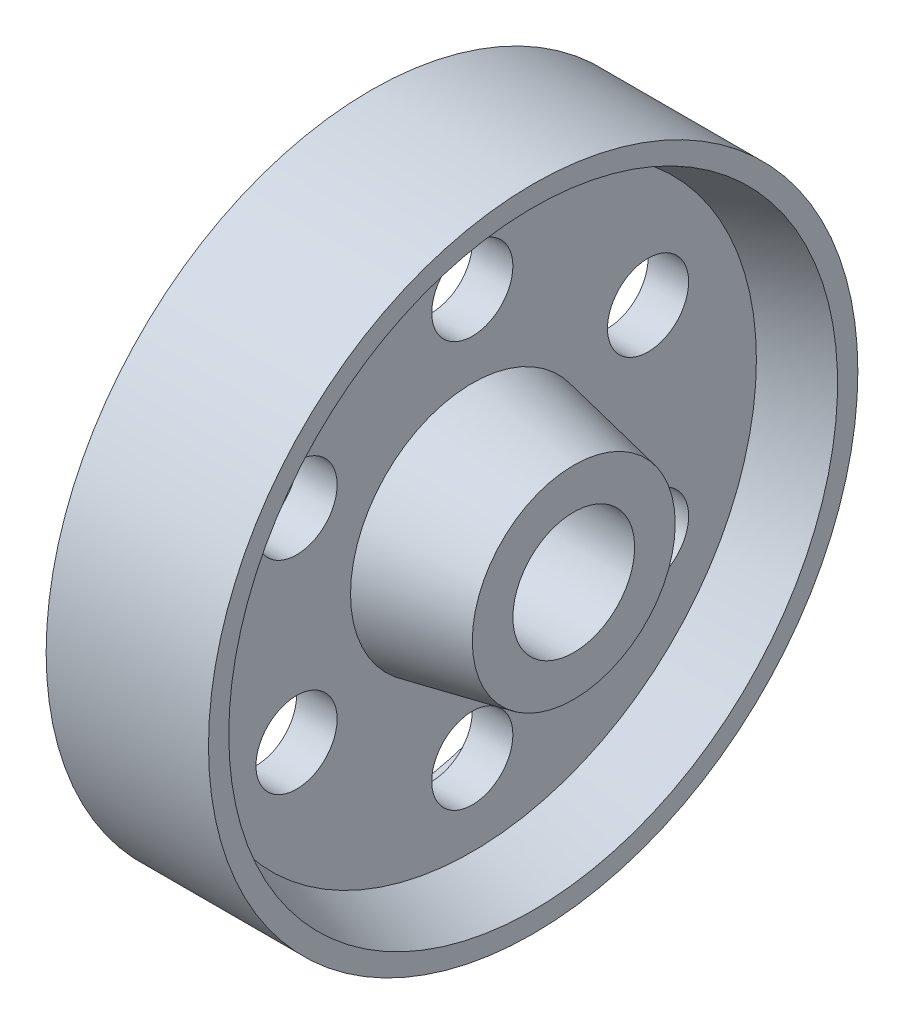
from build123d import *

# Parameters (mm, degrees)
SKETCH2_R          = 6.35
CUT_EXTRUDE1_DEPTH = 76.201267443
CIRPATTERN1_COUNT  = 6


with BuildPart() as part:
    # Sketch1 → Revolve1 (revolve)
    with BuildSketch(Plane.XY, mode=Mode.PRIVATE) as revolve1_sk:
        Polygon((0, 50.8), (0, 9.525), (19.05, 9.525), (19.05, 15.875), (3.175, 19.05), (3.175, 44.45), (12.7, 47.625), (12.7, 50.8), align=None)
    revolve1 = revolve(revolve1_sk.sketch.rotate(Axis((0, 0, 0), (1, 0, 0)), 90), axis=Axis((0, 0, 0), (1, 0, 0)))

    # Mirror1: Revolve1 across plane
    add(revolve1.mirror(Plane(origin=(0, 50.8, 0), x_dir=(0, 0, 1), z_dir=(1, 0, 0))))

    # Sketch2 → Cut-Extrude1 (cut, through all)
    with BuildSketch(Plane(origin=(3.175, 0, 0), x_dir=(0, 0, -1), z_dir=(1, 0, 0))):
        with Locations((27.49630657, 15.875)):
            Circle(SKETCH2_R)
    cut_extrude1 = extrude(amount=-CUT_EXTRUDE1_DEPTH, mode=Mode.SUBTRACT)

    # CirPattern1: Cut-Extrude1 ×6 about axis
    cirpattern1_axis = Axis((0, 0, 0), (1, 0, 0))
    for i in range(1, CIRPATTERN1_COUNT):
        add(cut_extrude1.rotate(cirpattern1_axis, i * 360 / CIRPATTERN1_COUNT), mode=Mode.SUBTRACT)


solid = part.part
